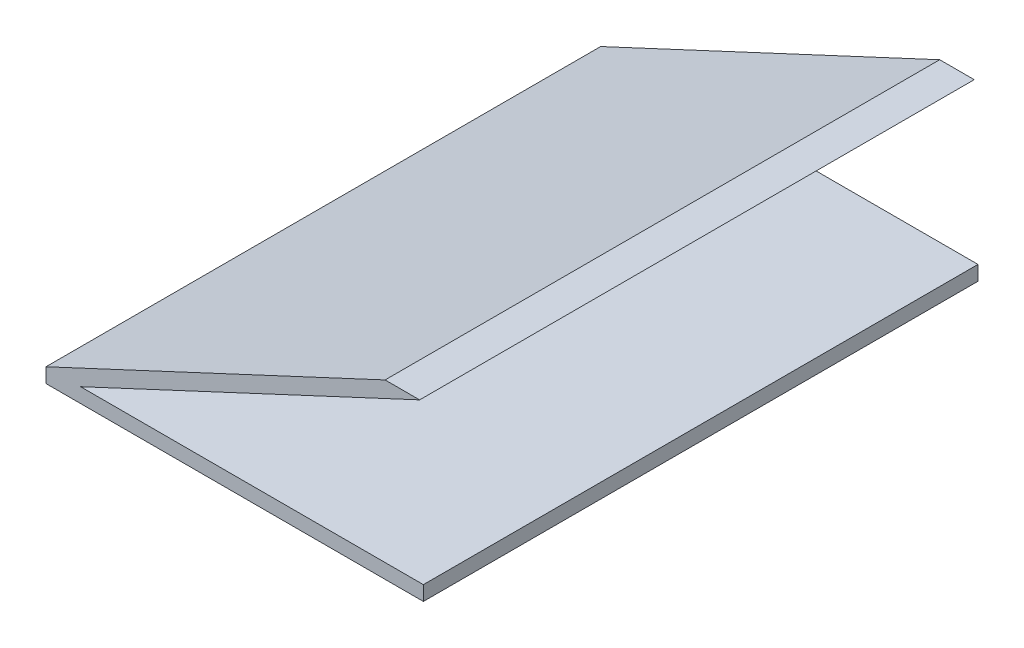
from build123d import *

# Parameters (mm, degrees)
EXTRUDE_1_DEPTH     = 380
CUT_EXTRUDE_1_DEPTH = 473.016948848


with BuildPart() as part:
    # 草图2 → 凸台-拉伸1 (new body)
    with BuildSketch(Plane.XY):
        Polygon((0, 0), (-253.76618037, -118.333113287), (26.23381963, -118.333113287), (26.23381963, -108.333113287), (-208.659095334, -108.333113287), (23.662015832, 0), align=None)
    extrude(amount=EXTRUDE_1_DEPTH)

    # 草图3 → 切除-拉伸1 (cut, through all)
    with BuildSketch(Plane.XY.offset(380)):
        Polygon((-232.321111165, -108.333113287), (-253.76618037, -118.333113287), (-232.321111165, -118.333113287), align=None)
    extrude(amount=-CUT_EXTRUDE_1_DEPTH, mode=Mode.SUBTRACT)


solid = part.part
